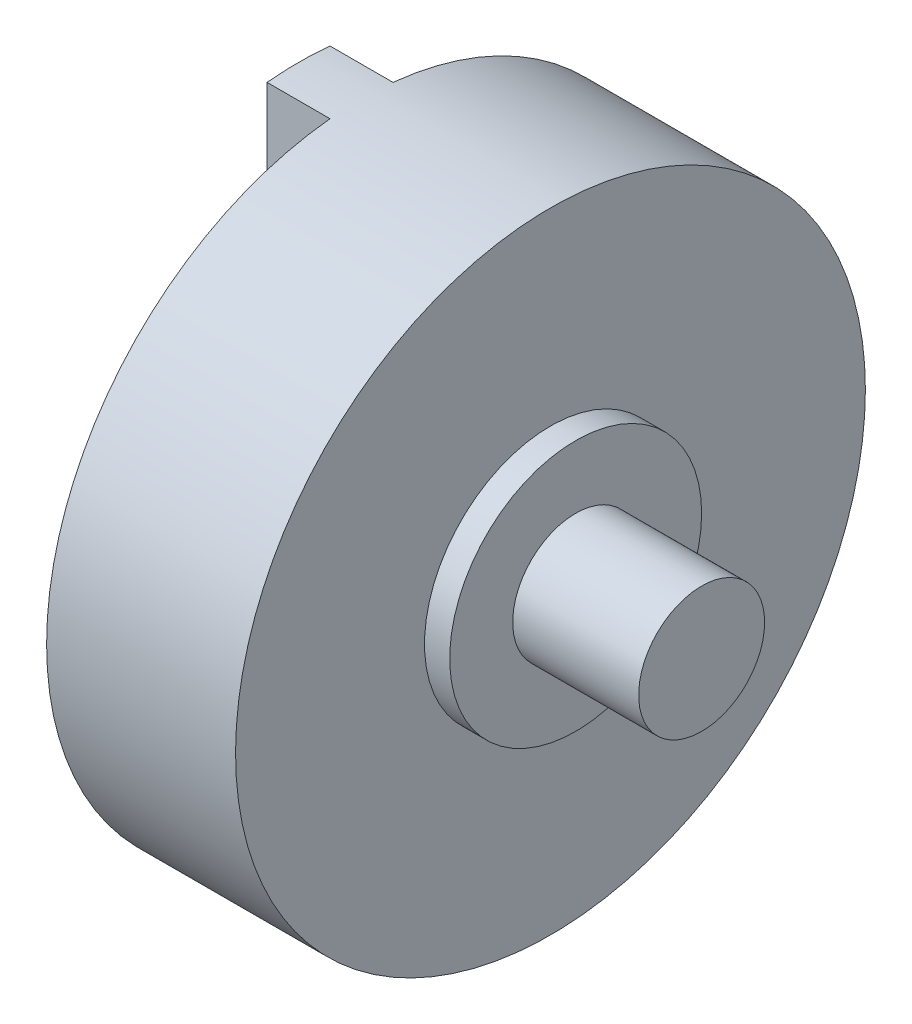
from build123d import *

# Parameters (mm, degrees)
SKETCH1_R           = 25
BOSS_EXTRUDE1_DEPTH = 7.5
SKETCH2_R           = 5
BOSS_EXTRUDE2_DEPTH = 12
BOSS_EXTRUDE3_DEPTH = 5
SKETCH4_R           = 10
BOSS_EXTRUDE4_DEPTH = 2


with BuildPart() as part:
    # Sketch1 → Boss-Extrude1 (new, symmetric)
    with BuildSketch(Plane(origin=(0, 0, 0), x_dir=(0, 0, -1), z_dir=(1, 0, 0))):
        Circle(SKETCH1_R)
    extrude(amount=BOSS_EXTRUDE1_DEPTH, both=True)

    # Sketch2 → Boss-Extrude2 (add)
    with BuildSketch(Plane(origin=(7.5, 0, 0), x_dir=(0, 0, -1), z_dir=(1, 0, 0))):
        Circle(SKETCH2_R)
    extrude(amount=BOSS_EXTRUDE2_DEPTH)

    # Sketch3 → Boss-Extrude3 (add)
    with BuildSketch(Plane.ZY.offset(7.5)):
        with BuildLine():
            Line((2.5, 24.874685928), (2.5, -24.874685928))
            ThreePointArc((2.5, -24.874685928), (0, -25), (-2.5, -24.874685928))
            Line((-2.5, -24.874685928), (-2.5, 24.874685928))
            ThreePointArc((-2.5, 24.874685928), (0, 25), (2.5, 24.874685928))
        make_face()
    extrude(amount=BOSS_EXTRUDE3_DEPTH)

    # Sketch4 → Boss-Extrude4 (add)
    with BuildSketch(Plane(origin=(7.5, 0, 0), x_dir=(0, 0, -1), z_dir=(1, 0, 0))):
        Circle(SKETCH4_R)
    extrude(amount=BOSS_EXTRUDE4_DEPTH)


solid = part.part
